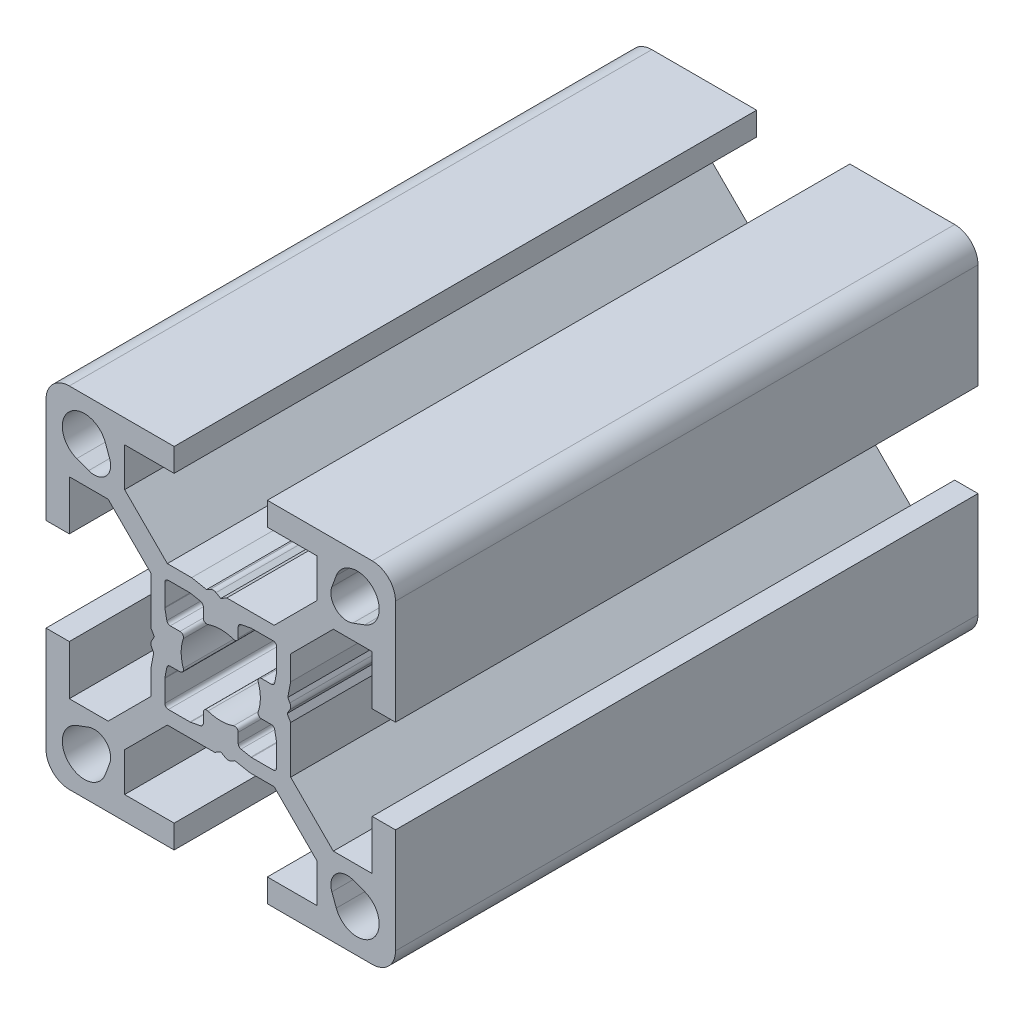
from build123d import *

# Parameters (mm, degrees)
BOSS_EXTRUDE1_DEPTH = 50
CUT_EXTRUDE1_DEPTH  = 50


with BuildPart() as part:
    # Sketch1 → Boss-Extrude1 (new body)
    with BuildSketch(Plane.XY):
        with BuildLine():
            Line((-15, 4), (-13, 4))
            Line((-13, 4), (-13, 8.25))
            Line((-13, 8.25), (-9.664213562, 8.25))
            Line((-9.664213562, 8.25), (-6, 4.585786438))
            Line((-6, 4.585786438), (-6, 0.519615242))
            Line((-6, 0.519615242), (-5.7, 0))
            Line((-5.7, 0), (-5.933012702, -0.403589838))
            ThreePointArc((-5.933012702, -0.403589838), (-6, -0.653589838), (-5.933012702, -0.903589838))
            Line((-5.933012702, -0.903589838), (-5.750976592, -1.218885629))
            Line((-5.750976592, -1.218885629), (-6, -2.5))
            Line((-6, -2.5), (-6, -4.585786438))
            Line((-6, -4.585786438), (-9.664213562, -8.25))
            Line((-9.664213562, -8.25), (-13, -8.25))
            Line((-13, -8.25), (-13, -4))
            Line((-13, -4), (-15, -4))
            Line((-15, -4), (-15, -13))
            ThreePointArc((-15, -13), (-14.414213562, -14.414213562), (-13, -15))
            Line((-13, -15), (-4, -15))
            Line((-4, -15), (-4, -13))
            Line((-4, -13), (-8.25, -13))
            Line((-8.25, -13), (-8.25, -9.664213562))
            Line((-8.25, -9.664213562), (-4.585786438, -6))
            Line((-4.585786438, -6), (-0.519615242, -6))
            Line((-0.519615242, -6), (0, -5.7))
            Line((0, -5.7), (0.403589838, -5.933012702))
            ThreePointArc((0.403589838, -5.933012702), (0.653589838, -6), (0.903589838, -5.933012702))
            Line((0.903589838, -5.933012702), (1.218885629, -5.750976592))
            Line((1.218885629, -5.750976592), (2.5, -6))
            Line((2.5, -6), (4.585786438, -6))
            Line((4.585786438, -6), (8.25, -9.664213562))
            Line((8.25, -9.664213562), (8.25, -13))
            Line((8.25, -13), (4, -13))
            Line((4, -13), (4, -15))
            Line((4, -15), (13, -15))
            ThreePointArc((13, -15), (14.414213562, -14.414213562), (15, -13))
            Line((15, -13), (15, -4))
            Line((15, -4), (13, -4))
            Line((13, -4), (13, -8.25))
            Line((13, -8.25), (9.664213562, -8.25))
            Line((9.664213562, -8.25), (6, -4.585786438))
            Line((6, -4.585786438), (6, -0.519615242))
            Line((6, -0.519615242), (5.7, 0))
            Line((5.7, 0), (5.933012702, 0.403589838))
            ThreePointArc((5.933012702, 0.403589838), (6, 0.653589838), (5.933012702, 0.903589838))
            Line((5.933012702, 0.903589838), (5.750976592, 1.218885629))
            Line((5.750976592, 1.218885629), (6, 2.5))
            Line((6, 2.5), (6, 4.585786438))
            Line((6, 4.585786438), (9.664213562, 8.25))
            Line((9.664213562, 8.25), (13, 8.25))
            Line((13, 8.25), (13, 4))
            Line((13, 4), (15, 4))
            Line((15, 4), (15, 13))
            ThreePointArc((15, 13), (14.414213562, 14.414213562), (13, 15))
            Line((13, 15), (4, 15))
            Line((4, 15), (4, 13))
            Line((4, 13), (8.25, 13))
            Line((8.25, 13), (8.25, 9.664213562))
            Line((8.25, 9.664213562), (4.585786438, 6))
            Line((4.585786438, 6), (0.519615242, 6))
            Line((0.519615242, 6), (0, 5.7))
            Line((0, 5.7), (-0.403589838, 5.933012702))
            ThreePointArc((-0.403589838, 5.933012702), (-0.653589838, 6), (-0.903589838, 5.933012702))
            Line((-0.903589838, 5.933012702), (-1.218885629, 5.750976592))
            Line((-1.218885629, 5.750976592), (-2.5, 6))
            Line((-2.5, 6), (-4.585786438, 6))
            Line((-4.585786438, 6), (-8.25, 9.664213562))
            Line((-8.25, 9.664213562), (-8.25, 13))
            Line((-8.25, 13), (-4, 13))
            Line((-4, 13), (-4, 15))
            Line((-4, 15), (-13, 15))
            ThreePointArc((-13, 15), (-14.414213562, 14.414213562), (-15, 13))
            Line((-15, 13), (-15, 4))
        make_face()
        with BuildLine():
            Line((11.338915743, 9.539070071), (12.361530981, 9.918883282))
            ThreePointArc((12.361530981, 9.918883282), (13.043502884, 13.043502884), (9.918883282, 12.361530981))
            Line((9.918883282, 12.361530981), (9.539070071, 11.338915743))
            ThreePointArc((9.539070071, 11.338915743), (9.861522369, 9.861522369), (11.338915743, 9.539070071))
        make_face(mode=Mode.SUBTRACT)
        with BuildLine():
            Line((9.539070071, -11.338915743), (9.918883282, -12.361530981))
            ThreePointArc((9.918883282, -12.361530981), (13.043502884, -13.043502884), (12.361530981, -9.918883282))
            Line((12.361530981, -9.918883282), (11.338915743, -9.539070071))
            ThreePointArc((11.338915743, -9.539070071), (9.861522369, -9.861522369), (9.539070071, -11.338915743))
        make_face(mode=Mode.SUBTRACT)
        with BuildLine():
            Line((-12.361530981, 9.918883282), (-11.338915743, 9.539070071))
            ThreePointArc((-11.338915743, 9.539070071), (-9.861522369, 9.861522369), (-9.539070071, 11.338915743))
            Line((-9.539070071, 11.338915743), (-9.918883282, 12.361530981))
            ThreePointArc((-9.918883282, 12.361530981), (-13.043502884, 13.043502884), (-12.361530981, 9.918883282))
        make_face(mode=Mode.SUBTRACT)
        with BuildLine():
            Line((-9.918883282, -12.361530981), (-9.539070071, -11.338915743))
            ThreePointArc((-9.539070071, -11.338915743), (-9.861522369, -9.861522369), (-11.338915743, -9.539070071))
            Line((-11.338915743, -9.539070071), (-12.361530981, -9.918883282))
            ThreePointArc((-12.361530981, -9.918883282), (-13.043502884, -13.043502884), (-9.918883282, -12.361530981))
        make_face(mode=Mode.SUBTRACT)
    extrude(amount=-BOSS_EXTRUDE1_DEPTH)

    # Sketch2 → Cut-Extrude1 (cut)
    with BuildSketch(Plane.XY):
        with BuildLine():
            Line((-4.5, -4.8), (-2.644433572, -4.8))
            ThreePointArc((-2.644433572, -4.8), (-2.615679847, -4.79861886), (-2.587190874, -4.794488155))
            Line((-2.587190874, -4.794488155), (-1.742757301, -4.630346896))
            ThreePointArc((-1.742757301, -4.630346896), (-1.568512625, -4.526682207), (-1.5, -4.335858741))
            Line((-1.5, -4.335858741), (-1.5, -3.5))
            ThreePointArc((-1.5, -3.5), (-1.374371466, -3.255879964), (-1.10270272, -3.21621621))
            ThreePointArc((-1.10270272, -3.21621621), (-9e-09, -3.4), (1.102702703, -3.216216216))
            ThreePointArc((1.102702703, -3.216216216), (1.374371458, -3.255879959), (1.5, -3.5))
            Line((1.5, -3.5), (1.5, -4.335858741))
            ThreePointArc((1.5, -4.335858741), (1.568512625, -4.526682207), (1.742757301, -4.630346896))
            Line((1.742757301, -4.630346896), (2.587190874, -4.794488155))
            ThreePointArc((2.587190874, -4.794488155), (2.615679847, -4.79861886), (2.644433572, -4.8))
            Line((2.644433572, -4.8), (4.5, -4.8))
            ThreePointArc((4.5, -4.8), (4.712132034, -4.712132034), (4.8, -4.5))
            Line((4.8, -4.5), (4.8, -2.644433572))
            ThreePointArc((4.8, -2.644433572), (4.79861886, -2.615679847), (4.794488155, -2.587190874))
            Line((4.794488155, -2.587190874), (4.630346896, -1.742757301))
            ThreePointArc((4.630346896, -1.742757301), (4.526682207, -1.568512625), (4.335858741, -1.5))
            Line((4.335858741, -1.5), (3.5, -1.5))
            ThreePointArc((3.5, -1.5), (3.255879964, -1.374371466), (3.21621621, -1.10270272))
            ThreePointArc((3.21621621, -1.10270272), (3.4, -9e-09), (3.216216216, 1.102702703))
            ThreePointArc((3.216216216, 1.102702703), (3.255879959, 1.374371458), (3.5, 1.5))
            Line((3.5, 1.5), (4.335858741, 1.5))
            ThreePointArc((4.335858741, 1.5), (4.526682207, 1.568512625), (4.630346896, 1.742757301))
            Line((4.630346896, 1.742757301), (4.794488155, 2.587190874))
            ThreePointArc((4.794488155, 2.587190874), (4.79861886, 2.615679847), (4.8, 2.644433572))
            Line((4.8, 2.644433572), (4.8, 4.5))
            ThreePointArc((4.8, 4.5), (4.712132034, 4.712132034), (4.5, 4.8))
            Line((4.5, 4.8), (2.644433572, 4.8))
            ThreePointArc((2.644433572, 4.8), (2.615679847, 4.79861886), (2.587190874, 4.794488155))
            Line((2.587190874, 4.794488155), (1.742757301, 4.630346896))
            ThreePointArc((1.742757301, 4.630346896), (1.568512625, 4.526682207), (1.5, 4.335858741))
            Line((1.5, 4.335858741), (1.5, 3.5))
            ThreePointArc((1.5, 3.5), (1.374371466, 3.255879964), (1.10270272, 3.21621621))
            ThreePointArc((1.10270272, 3.21621621), (9e-09, 3.4), (-1.102702703, 3.216216216))
            ThreePointArc((-1.102702703, 3.216216216), (-1.374371458, 3.255879959), (-1.5, 3.5))
            Line((-1.5, 3.5), (-1.5, 4.335858741))
            ThreePointArc((-1.5, 4.335858741), (-1.568512625, 4.526682207), (-1.742757301, 4.630346896))
            Line((-1.742757301, 4.630346896), (-2.587190874, 4.794488155))
            ThreePointArc((-2.587190874, 4.794488155), (-2.615679847, 4.79861886), (-2.644433572, 4.8))
            Line((-2.644433572, 4.8), (-4.5, 4.8))
            ThreePointArc((-4.5, 4.8), (-4.712132034, 4.712132034), (-4.8, 4.5))
            Line((-4.8, 4.5), (-4.8, 2.644433572))
            ThreePointArc((-4.8, 2.644433572), (-4.79861886, 2.615679847), (-4.794488155, 2.587190874))
            Line((-4.794488155, 2.587190874), (-4.630346896, 1.742757301))
            ThreePointArc((-4.630346896, 1.742757301), (-4.526682207, 1.568512625), (-4.335858741, 1.5))
            Line((-4.335858741, 1.5), (-3.5, 1.5))
            ThreePointArc((-3.5, 1.5), (-3.255879964, 1.374371466), (-3.21621621, 1.10270272))
            ThreePointArc((-3.21621621, 1.10270272), (-3.4, 9e-09), (-3.216216216, -1.102702703))
            ThreePointArc((-3.216216216, -1.102702703), (-3.255879959, -1.374371458), (-3.5, -1.5))
            Line((-3.5, -1.5), (-4.335858741, -1.5))
            ThreePointArc((-4.335858741, -1.5), (-4.526682207, -1.568512625), (-4.630346896, -1.742757301))
            Line((-4.630346896, -1.742757301), (-4.794488155, -2.587190874))
            ThreePointArc((-4.794488155, -2.587190874), (-4.79861886, -2.615679847), (-4.8, -2.644433572))
            Line((-4.8, -2.644433572), (-4.8, -4.5))
            ThreePointArc((-4.8, -4.5), (-4.712132034, -4.712132034), (-4.5, -4.8))
        make_face()
    extrude(amount=-CUT_EXTRUDE1_DEPTH, mode=Mode.SUBTRACT)


solid = part.part
